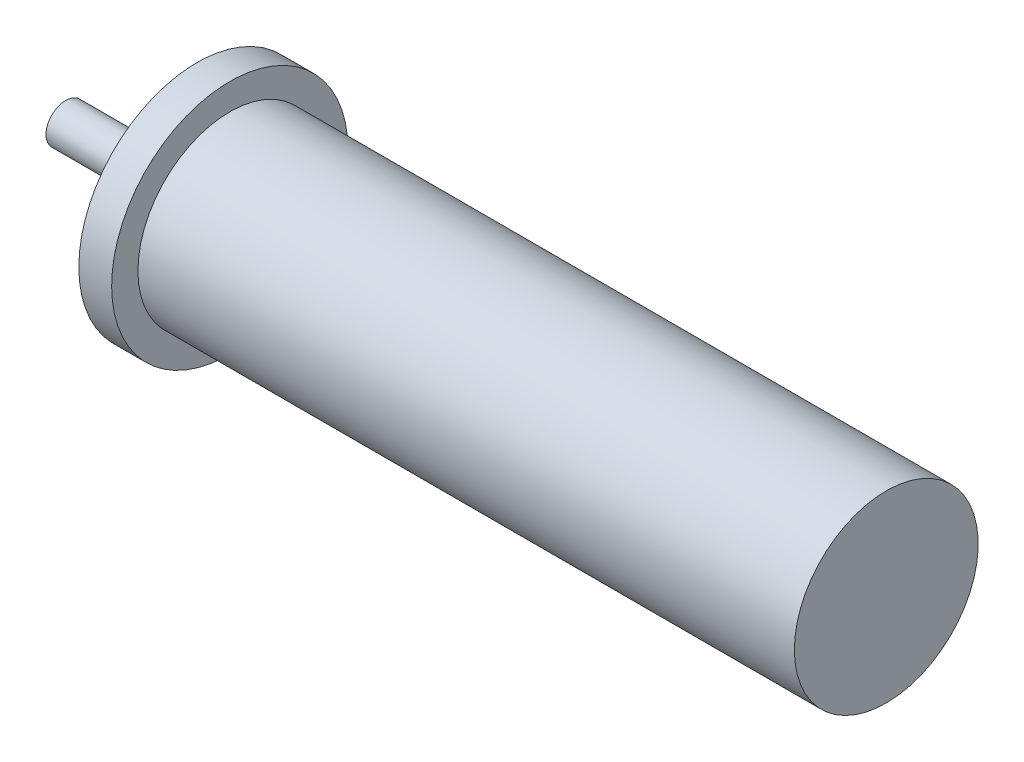
from build123d import *


with BuildPart() as part:
    # Sketch1 → Revolve1 (revolve)
    with BuildSketch(Plane.XY, mode=Mode.PRIVATE) as revolve1_sk:
        Polygon((0, 3), (0, 0), (125, 0), (125, 14), (25, 14), (25, 18), (20, 18), (20, 11), (18, 11), (18, 3), align=None)
    revolve(revolve1_sk.sketch.rotate(Axis((0, 0, 0), (1, 0, 0)), 90), axis=Axis((0, 0, 0), (1, 0, 0)))


solid = part.part
